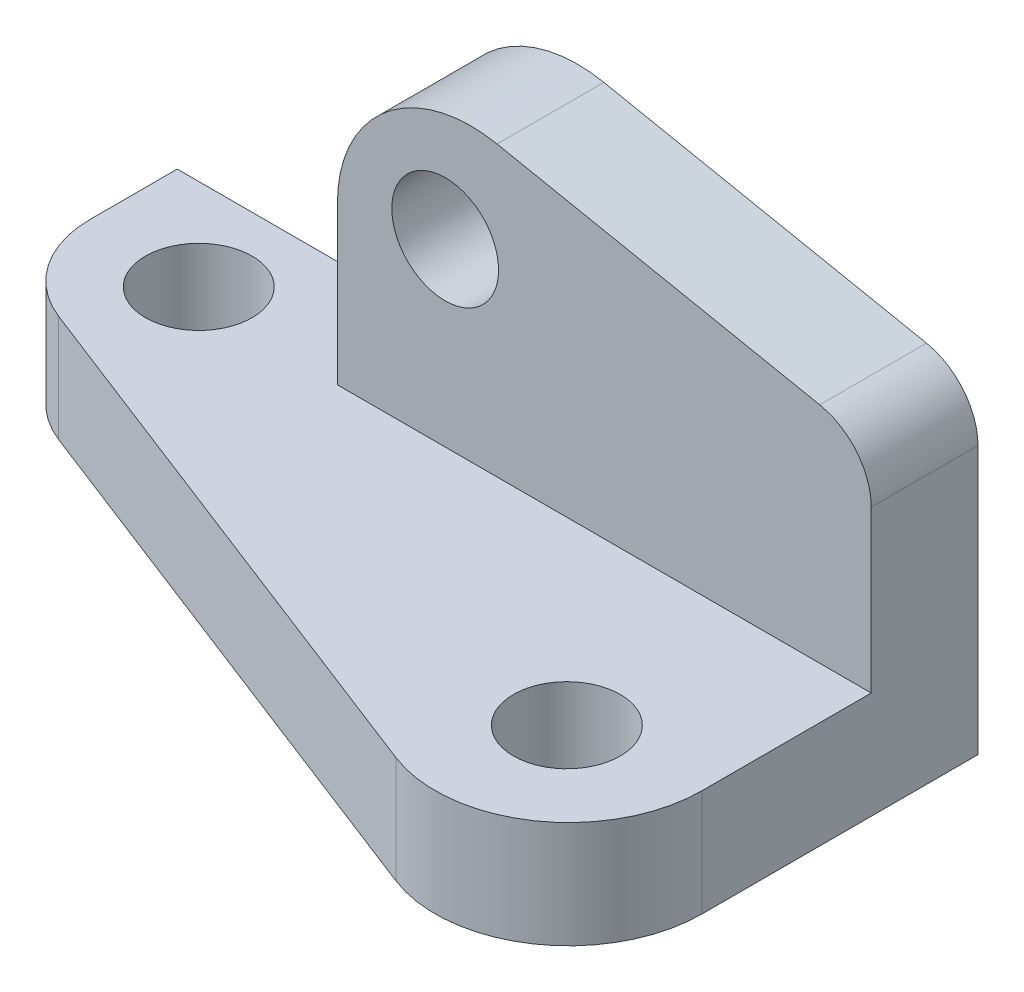
from build123d import *

# Parameters (mm, degrees)
BOSS_EXTRUDE1_DEPTH    = 20
BOSS_EXTRUDE4_DEPTH    = 20
FILLET1_R              = 25
FILLET2_R              = 12
F_20_0MM_DOWEL_HOLE2_D = 20
F_20_0MM_DOWEL_HOLE4_D = 20
F_20_0MM_DOWEL_HOLE5_D = 20


with BuildPart() as part:
    # Sketch1 → Boss-Extrude1 (new body)
    with BuildSketch(Plane(origin=(0, 0, 0), x_dir=(1, 0, 0), z_dir=(0, 1, 0))):
        with BuildLine():
            Line((0, 0), (150, 0))
            Line((150, 0), (150, -51.689934114))
            ThreePointArc((150, -51.689934114), (139.12642407, -72.316231479), (115.964468561, -75))
            Line((115.964468561, -75), (12.771574849, -35))
            ThreePointArc((12.771574849, -35), (3.498962108, -27.653086547), (0, -16.351947291))
            Line((0, -16.351947291), (0, 0))
        make_face()
    extrude(amount=BOSS_EXTRUDE1_DEPTH)

    # Sketch3 → Boss-Extrude4 (add)
    with BuildSketch(Plane.XY):
        Polygon((150, 0), (50, 0), (50, 80), (150, 60), align=None)
    extrude(amount=BOSS_EXTRUDE4_DEPTH)

    # Fillet1
    fillet1_edges = [part.edges().sort_by_distance(p)[0] for p in [
        (50, 80, 10),
    ]]
    fillet(fillet1_edges, radius=FILLET1_R)

    # Fillet2
    fillet2_edges = [part.edges().sort_by_distance(p)[0] for p in [
        (150, 60, 10),
    ]]
    fillet(fillet2_edges, radius=FILLET2_R)

    # Ø20.0mm Dowel Hole2 (through all)
    with Locations(Plane.XY.offset(20)):
        with Locations((70.185160084, 53.713740801)):
            Hole(F_20_0MM_DOWEL_HOLE2_D / 2)

    # Ø20.0mm Dowel Hole4 (through all)
    with Locations(Plane(origin=(0, 20, 0), x_dir=(1, 0, 0), z_dir=(0, 1, 0))):
        with Locations((21.126269386, -17.1033247)):
            Hole(F_20_0MM_DOWEL_HOLE4_D / 2)

    # Ø20.0mm Dowel Hole5 (through all)
    with Locations(Plane(origin=(0, 20, 0), x_dir=(1, 0, 0), z_dir=(0, 1, 0))):
        with Locations((126.71878139, -53.737461518)):
            Hole(F_20_0MM_DOWEL_HOLE5_D / 2)


solid = part.part
